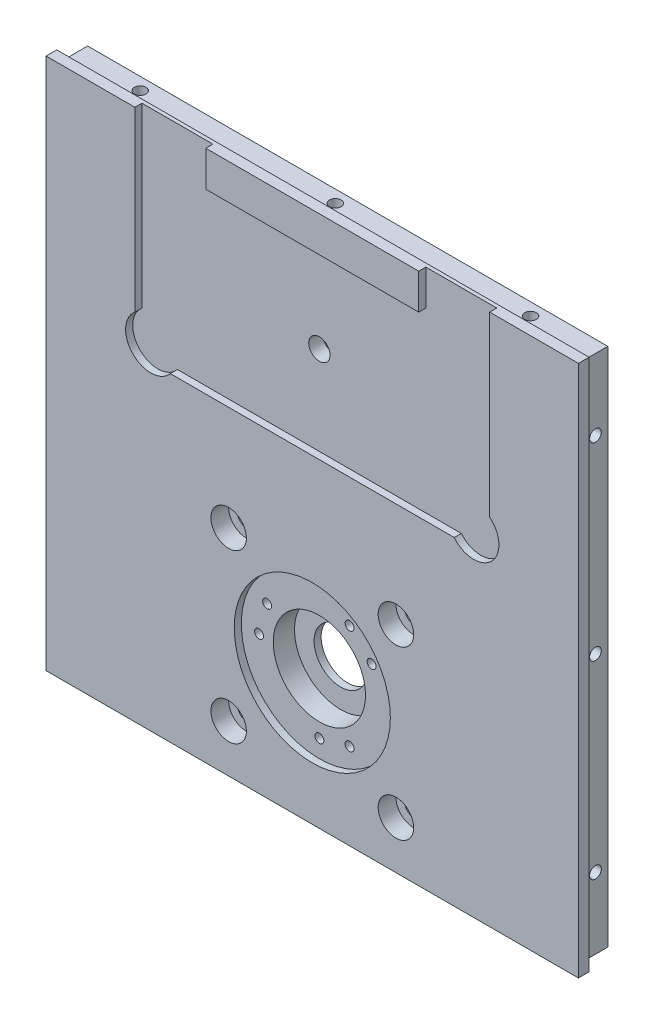
from build123d import *

# Parameters (mm, degrees)
SKETCH_1_W           = 150
SKETCH_1_H           = 150
EXTRUDE_1_DEPTH      = 10
SKETCH_2_R           = 13
CUT_EXTRUDE_1_DEPTH  = 8
SKETCH_3_R           = 7.5
CUT_EXTRUDE_3_DEPTH  = 213.367605816
SKETCH_4_R           = 22
CUT_EXTRUDE_4_DEPTH  = 2
SKETCH_5_R           = 2.5
CUT_EXTRUDE_5_DEPTH  = 213.367605816
SKETCH_6_W           = 163.457358394
SKETCH_6_H           = 157.320035801
SKETCH_6_W_2         = 146.6
SKETCH_6_H_2         = 146.6
CUT_EXTRUDE_6_DEPTH  = 7
SKETCH_7_R           = 1.65
CUT_EXTRUDE_7_DEPTH  = 15
CUT_EXTRUDE_START    = -15
SKETCH_8_R           = 1.65
CUT_EXTRUDE_8_DEPTH  = 15
SKETCH_9_R           = 1.65
CUT_EXTRUDE_9_DEPTH  = 15
SKETCH_10_R          = 1.65
CUT_EXTRUDE_10_DEPTH = 15
SKETCH_12_R          = 1.25
CUT_EXTRUDE_11_DEPTH = 213.367605816
SKETCH_14_R          = 5
CUT_EXTRUDE_12_DEPTH = 5
SKETCH_15_W          = 100
SKETCH_15_H          = 50
CUT_EXTRUDE_13_DEPTH = 2
SKETCH_16_R          = 7.1
CUT_EXTRUDE_14_DEPTH = 2
SKETCH_17_R          = 3
CUT_EXTRUDE_15_DEPTH = 213.367605816
SKETCH_18_W          = 20
SKETCH_18_H          = 10
CUT_EXTRUDE_16_DEPTH = 2
CUT_EXTRUDE_17_DEPTH = 4
SKETCH_20_R          = 1.35
CUT_EXTRUDE_18_DEPTH = 4


with BuildPart() as part:
    # Эскиз1 → Бобышка-Вытянуть1 (new body)
    with BuildSketch(Plane.XY):
        with Locations((75, 75)):
            Rectangle(SKETCH_1_W, SKETCH_1_H)
    extrude(amount=EXTRUDE_1_DEPTH)

    # Эскиз2 → Вырез-Вытянуть1 (cut)
    with BuildSketch(Plane.XY.offset(10)):
        with Locations((75, 37)):
            Circle(SKETCH_2_R)
    extrude(amount=-CUT_EXTRUDE_1_DEPTH, mode=Mode.SUBTRACT)

    # Эскиз3 → Вырез-Вытянуть3 (cut, through all)
    with BuildSketch(Plane.XY.offset(10)):
        with Locations((75, 37)):
            Circle(SKETCH_3_R)
    extrude(amount=-CUT_EXTRUDE_3_DEPTH, mode=Mode.SUBTRACT)

    # Эскиз4 → Вырез-Вытянуть4 (cut)
    with BuildSketch(Plane.XY.offset(10)):
        with Locations((75, 37)):
            Circle(SKETCH_4_R)
    extrude(amount=-CUT_EXTRUDE_4_DEPTH, mode=Mode.SUBTRACT)

    # Эскиз5 → Вырез-Вытянуть5 (cut, through all)
    with BuildSketch(Plane.XY.offset(10)):
        with Locations((51.43, 13.43)):
            Circle(SKETCH_5_R)
        with Locations((98.57, 13.43)):
            Circle(SKETCH_5_R)
        with Locations((98.57, 60.57)):
            Circle(SKETCH_5_R)
        with Locations((51.43, 60.57)):
            Circle(SKETCH_5_R)
    extrude(amount=-CUT_EXTRUDE_5_DEPTH, mode=Mode.SUBTRACT)

    # Эскиз6 → Вырез-Вытянуть6 (cut)
    with BuildSketch(Plane(origin=(0, 0, 0), x_dir=(-1, 0, 0), z_dir=(0, 0, -1))):
        with Locations((-77.352640327, 75.40915484)):
            Rectangle(SKETCH_6_W, SKETCH_6_H)
        with Locations((-75, 75)):
            Rectangle(SKETCH_6_W_2, SKETCH_6_H_2, mode=Mode.SUBTRACT)
    extrude(amount=-CUT_EXTRUDE_6_DEPTH, mode=Mode.SUBTRACT)

    # Эскиз7 → Вырез-Вытянуть7 (cut)
    with BuildSketch(Plane.XZ.offset(-1.7)):
        with Locations(Location((20, 3.5, 0), (0, 0, 270))):
            Circle(SKETCH_7_R)
        with Locations(Location((75, 3.5, 0), (0, 0, 270))):
            Circle(SKETCH_7_R)
        with Locations(Location((130, 3.5, 0), (0, 0, 270))):
            Circle(SKETCH_7_R)
    extrude(amount=-CUT_EXTRUDE_7_DEPTH, mode=Mode.SUBTRACT)

    # Эскиз8 → Вырез-Вытянуть8 (cut)
    with BuildSketch(Plane(origin=(0, 148.3, 0), x_dir=(1, 0, 0), z_dir=(0, 1, 0)).offset(CUT_EXTRUDE_START)):
        with Locations(Location((20, -3.5, 0), (0, 0, 90))):
            Circle(SKETCH_8_R)
        with Locations(Location((75, -3.5, 0), (0, 0, 90))):
            Circle(SKETCH_8_R)
        with Locations(Location((130, -3.5, 0), (0, 0, 90))):
            Circle(SKETCH_8_R)
    extrude(amount=CUT_EXTRUDE_8_DEPTH, mode=Mode.SUBTRACT)

    # Эскиз9 → Вырез-Вытянуть9 (cut)
    with BuildSketch(Plane(origin=(148.3, 0, 0), x_dir=(0, 0, -1), z_dir=(1, 0, 0))):
        with Locations(Location((-3.5, 21.7, 0), (0, 0, 90))):
            Circle(SKETCH_9_R)
        with Locations(Location((-3.5, 128.3, 0), (0, 0, 90))):
            Circle(SKETCH_9_R)
        with Locations(Location((-3.5, 75, 0), (0, 0, 90))):
            Circle(SKETCH_9_R)
    extrude(amount=-CUT_EXTRUDE_9_DEPTH, mode=Mode.SUBTRACT)

    # Эскиз10 → Вырез-Вытянуть10 (cut)
    with BuildSketch(Plane.ZY.offset(-1.7).offset(CUT_EXTRUDE_START)):
        with Locations(Location((3.5, 128.3, 0), (0, 0, 90))):
            Circle(SKETCH_10_R)
        with Locations(Location((3.5, 75, 0), (0, 0, 90))):
            Circle(SKETCH_10_R)
        with Locations(Location((3.5, 21.7, 0), (0, 0, 90))):
            Circle(SKETCH_10_R)
    extrude(amount=CUT_EXTRUDE_10_DEPTH, mode=Mode.SUBTRACT)

    # Эскиз12 → Вырез-Вытянуть11 (cut, through all)
    with BuildSketch(Plane.XY.offset(10)):
        with Locations((75, 20)):
            Circle(SKETCH_12_R)
        with Locations((60.277568136, 45.5)):
            Circle(SKETCH_12_R)
        with Locations((89.722431864, 45.5)):
            Circle(SKETCH_12_R)
        with Locations((58, 37)):
            Circle(SKETCH_12_R)
        with Locations((83.5, 22.277568136)):
            Circle(SKETCH_12_R)
        with Locations((83.5, 51.722431864)):
            Circle(SKETCH_12_R)
    extrude(amount=-CUT_EXTRUDE_11_DEPTH, mode=Mode.SUBTRACT)

    # Эскиз14 → Вырез-Вытянуть12 (cut)
    with BuildSketch(Plane.XY.offset(10)):
        with Locations((51.43, 13.43)):
            Circle(SKETCH_14_R)
        with Locations((98.57, 13.43)):
            Circle(SKETCH_14_R)
        with Locations((98.57, 60.57)):
            Circle(SKETCH_14_R)
        with Locations((51.43, 60.57)):
            Circle(SKETCH_14_R)
    extrude(amount=-CUT_EXTRUDE_12_DEPTH, mode=Mode.SUBTRACT)

    # Эскиз15 → Вырез-Вытянуть13 (cut)
    with BuildSketch(Plane.XY.offset(10)):
        with Locations((75, 115)):
            Rectangle(SKETCH_15_W, SKETCH_15_H)
    extrude(amount=-CUT_EXTRUDE_13_DEPTH, mode=Mode.SUBTRACT)

    # Эскиз16 → Вырез-Вытянуть14 (cut)
    with BuildSketch(Plane.XY.offset(10)):
        with Locations((29.5, 94.5)):
            Circle(SKETCH_16_R)
        with Locations((120.5, 94.5)):
            Circle(SKETCH_16_R)
    extrude(amount=-CUT_EXTRUDE_14_DEPTH, mode=Mode.SUBTRACT)

    # Эскиз17 → Вырез-Вытянуть15 (cut, through all)
    with BuildSketch(Plane.XY.offset(10)):
        with Locations((75, 115)):
            Circle(SKETCH_17_R)
    extrude(amount=-CUT_EXTRUDE_15_DEPTH, mode=Mode.SUBTRACT)

    # Эскиз18 → Вырез-Вытянуть16 (cut)
    with BuildSketch(Plane.XY.offset(10)):
        with Locations((35, 145)):
            Rectangle(SKETCH_18_W, SKETCH_18_H)
        with Locations((115, 145)):
            Rectangle(SKETCH_18_W, SKETCH_18_H)
    extrude(amount=-CUT_EXTRUDE_16_DEPTH, mode=Mode.SUBTRACT)

    # Эскиз19 → Вырез-Вытянуть17 (cut)
    with BuildSketch(Plane(origin=(0, 0, 0), x_dir=(-1, 0, 0), z_dir=(0, 0, -1))):
        Polygon((-69.226497308, 115), (-72.113248654, 120), (-77.886751346, 120), (-80.773502692, 115), (-77.886751346, 110), (-72.113248654, 110), align=None)
    extrude(amount=-CUT_EXTRUDE_17_DEPTH, mode=Mode.SUBTRACT)

    # Эскиз20 → Вырез-Вытянуть18 (cut)
    with BuildSketch(Plane(origin=(0, 0, 0), x_dir=(-1, 0, 0), z_dir=(0, 0, -1))):
        with Locations((-70.397013545, 115)):
            Circle(SKETCH_20_R)
        with Locations((-72.698506772, 111.013696796)):
            Circle(SKETCH_20_R)
        with Locations((-77.301493228, 111.013696796)):
            Circle(SKETCH_20_R)
        with Locations((-79.602986455, 115)):
            Circle(SKETCH_20_R)
        with Locations((-77.301493228, 118.986303204)):
            Circle(SKETCH_20_R)
        with Locations((-72.698506772, 118.986303204)):
            Circle(SKETCH_20_R)
    extrude(amount=-CUT_EXTRUDE_18_DEPTH, mode=Mode.SUBTRACT)


solid = part.part
